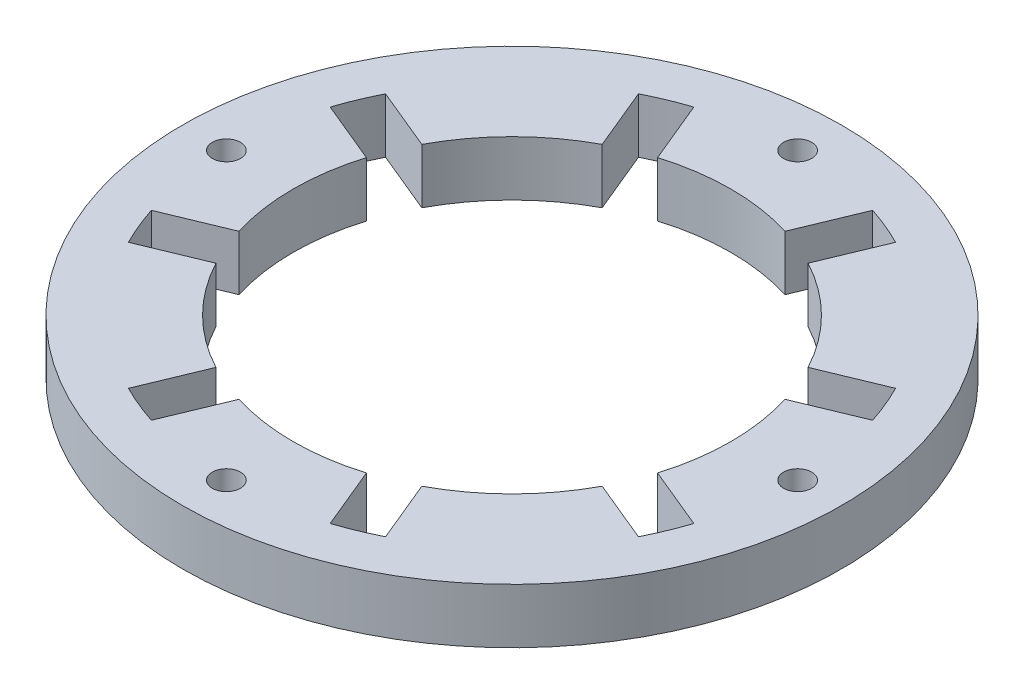
from build123d import *

# Parameters (mm, degrees)
SKETCH1_R           = 38.1
SKETCH1_R_2         = 1.6256
BOSS_EXTRUDE1_DEPTH = 6.35


with BuildPart() as part:
    # Sketch1 → Boss-Extrude1 (new body)
    with BuildSketch(Plane(origin=(0, 0, 0), x_dir=(1, 0, 0), z_dir=(0, 1, 0))):
        with Locations(Location((0, 0, 0), (0, 0, 270))):
            Circle(SKETCH1_R)
        with Locations(Location((0, 33.02, 0), (0, 0, 270))):
            Circle(SKETCH1_R_2, mode=Mode.SUBTRACT)
        with Locations(Location((33.02, 0, 0), (0, 0, 270))):
            Circle(SKETCH1_R_2, mode=Mode.SUBTRACT)
        with Locations(Location((0, -33.02, 0), (0, 0, 270))):
            Circle(SKETCH1_R_2, mode=Mode.SUBTRACT)
        with Locations(Location((-33.02, 0, 0), (0, 0, 270))):
            Circle(SKETCH1_R_2, mode=Mode.SUBTRACT)
        with BuildLine():
            Line((29.48483871, -14.864880969), (22.32486724, -11.89912368))
            ThreePointArc((22.32486724, -11.89912368), (17.888387876, -17.888387876), (11.89912368, -22.32486724))
            Line((11.89912368, -22.32486724), (14.864880969, -29.48483871))
            ThreePointArc((14.864880969, -29.48483871), (12.636206937, -30.506502164), (10.33787126, -31.359987529))
            Line((10.33787126, -31.359987529), (7.37211397, -24.200016059))
            ThreePointArc((7.37211397, -24.200016059), (0, -25.298000744), (-7.37211397, -24.200016059))
            Line((-7.37211397, -24.200016059), (-10.33787126, -31.359987529))
            ThreePointArc((-10.33787126, -31.359987529), (-12.636206937, -30.506502164), (-14.864880969, -29.48483871))
            Line((-14.864880969, -29.48483871), (-11.89912368, -22.32486724))
            ThreePointArc((-11.89912368, -22.32486724), (-17.888387876, -17.888387876), (-22.32486724, -11.89912368))
            Line((-22.32486724, -11.89912368), (-29.48483871, -14.864880969))
            ThreePointArc((-29.48483871, -14.864880969), (-30.506502164, -12.636206937), (-31.359987529, -10.33787126))
            Line((-31.359987529, -10.33787126), (-24.200016059, -7.37211397))
            ThreePointArc((-24.200016059, -7.37211397), (-25.298000744, 0), (-24.200016059, 7.37211397))
            Line((-24.200016059, 7.37211397), (-31.359987529, 10.33787126))
            ThreePointArc((-31.359987529, 10.33787126), (-30.506502164, 12.636206937), (-29.48483871, 14.864880969))
            Line((-29.48483871, 14.864880969), (-22.32486724, 11.89912368))
            ThreePointArc((-22.32486724, 11.89912368), (-17.888387876, 17.888387876), (-11.89912368, 22.32486724))
            Line((-11.89912368, 22.32486724), (-14.864880969, 29.48483871))
            ThreePointArc((-14.864880969, 29.48483871), (-12.636206937, 30.506502164), (-10.33787126, 31.359987529))
            Line((-10.33787126, 31.359987529), (-7.37211397, 24.200016059))
            ThreePointArc((-7.37211397, 24.200016059), (0, 25.298000744), (7.37211397, 24.200016059))
            Line((7.37211397, 24.200016059), (10.33787126, 31.359987529))
            ThreePointArc((10.33787126, 31.359987529), (12.636206937, 30.506502164), (14.864880969, 29.48483871))
            Line((14.864880969, 29.48483871), (11.89912368, 22.32486724))
            ThreePointArc((11.89912368, 22.32486724), (17.888387876, 17.888387876), (22.32486724, 11.89912368))
            Line((22.32486724, 11.89912368), (29.48483871, 14.864880969))
            ThreePointArc((29.48483871, 14.864880969), (30.506502164, 12.636206937), (31.359987529, 10.33787126))
            Line((31.359987529, 10.33787126), (24.200016059, 7.37211397))
            ThreePointArc((24.200016059, 7.37211397), (25.298000744, 0), (24.200016059, -7.37211397))
            Line((24.200016059, -7.37211397), (31.359987529, -10.33787126))
            ThreePointArc((31.359987529, -10.33787126), (30.506502164, -12.636206937), (29.48483871, -14.864880969))
        make_face(mode=Mode.SUBTRACT)
    extrude(amount=BOSS_EXTRUDE1_DEPTH)


solid = part.part
